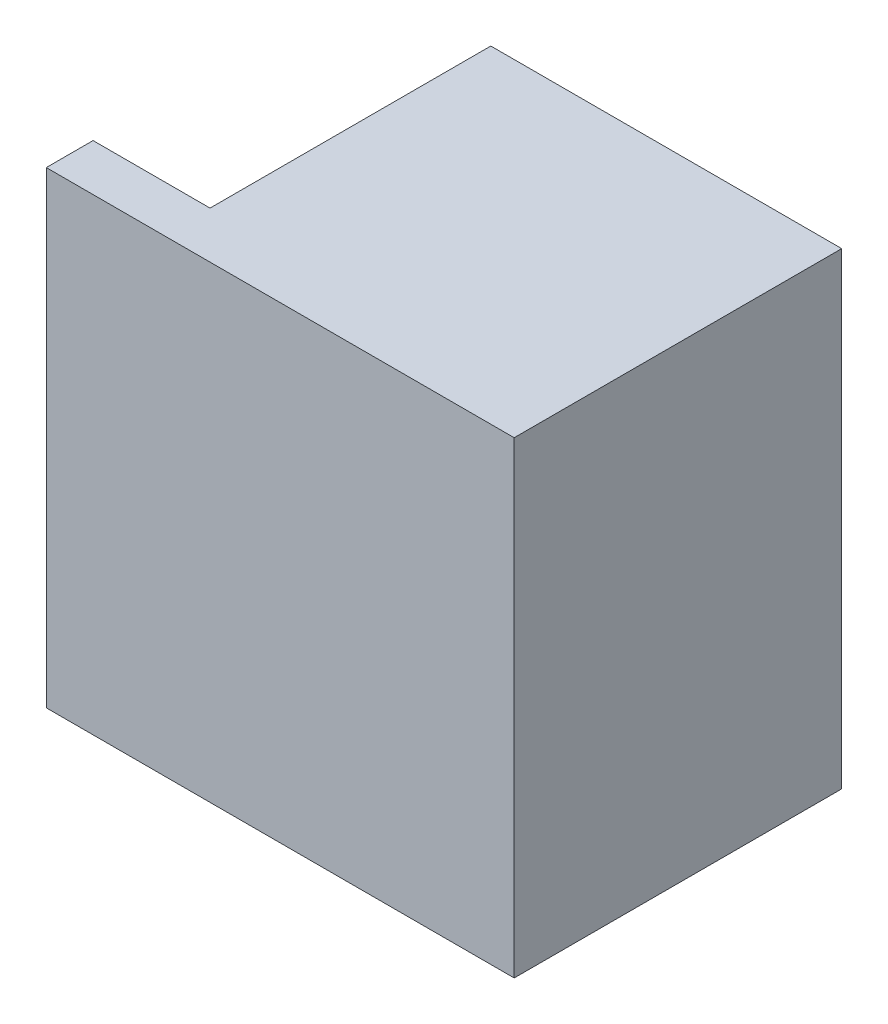
from build123d import *

# Parameters (mm, degrees)
SKETCH1_W           = 20
SKETCH1_H           = 20
BOSS_EXTRUDE1_DEPTH = 14
CUT_EXTRUDE1_DEPTH  = 12


with BuildPart() as part:
    # Sketch1 → Boss-Extrude1 (new body)
    with BuildSketch(Plane.XY):
        Rectangle(SKETCH1_W, SKETCH1_H)
    extrude(amount=BOSS_EXTRUDE1_DEPTH)

    # Sketch2 → Cut-Extrude1 (cut)
    with BuildSketch(Plane(origin=(0, 0, 0), x_dir=(-1, 0, 0), z_dir=(0, 0, -1))):
        Polygon((3, 8), (-8, 8), (-8, -8), (-5, -8), (-5, -10), (10, -10), (10, 10), (5, 10), (5, 3), (3, 3), align=None)
    extrude(amount=-CUT_EXTRUDE1_DEPTH, mode=Mode.SUBTRACT)


solid = part.part
